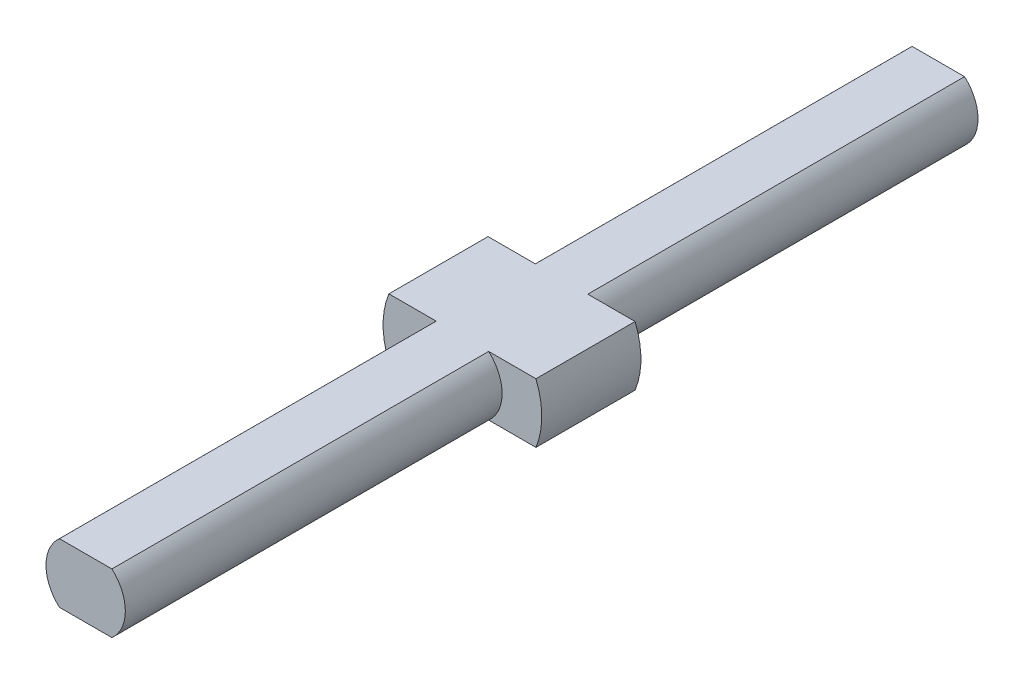
from build123d import *

# Parameters (mm, degrees)
CUT_EXTRUDE1_DEPTH      = 45.463468151
CUT_EXTRUDE1_DEPTH_BACK = 45.463468151
SKETCH2_W               = 16
SKETCH2_H               = 5


with BuildPart() as part:
    # Sketch1 → Revolve1 (revolve)
    with BuildSketch(Plane(origin=(0, 0, 0), x_dir=(1, 0, 0), z_dir=(0, 1, 0))):
        Polygon((4, 43), (4, 5), (8, 5), (8, -5), (4, -5), (4, -43), (0, -43), (0, 43), align=None)
    revolve(axis=Axis((0, 0, 43), (0, 0, -1)))

    # Sketch2 → Cut-Extrude1 (cut, two sides: drawn at the far end of the back side and taken through both)
    with BuildSketch(Plane.XY.offset(-CUT_EXTRUDE1_DEPTH_BACK)):
        with Locations((0, 5.5)):
            Rectangle(SKETCH2_W, SKETCH2_H)
        with Locations((0, -5.5)):
            Rectangle(SKETCH2_W, SKETCH2_H)
    extrude(amount=CUT_EXTRUDE1_DEPTH + CUT_EXTRUDE1_DEPTH_BACK, mode=Mode.SUBTRACT)


solid = part.part
